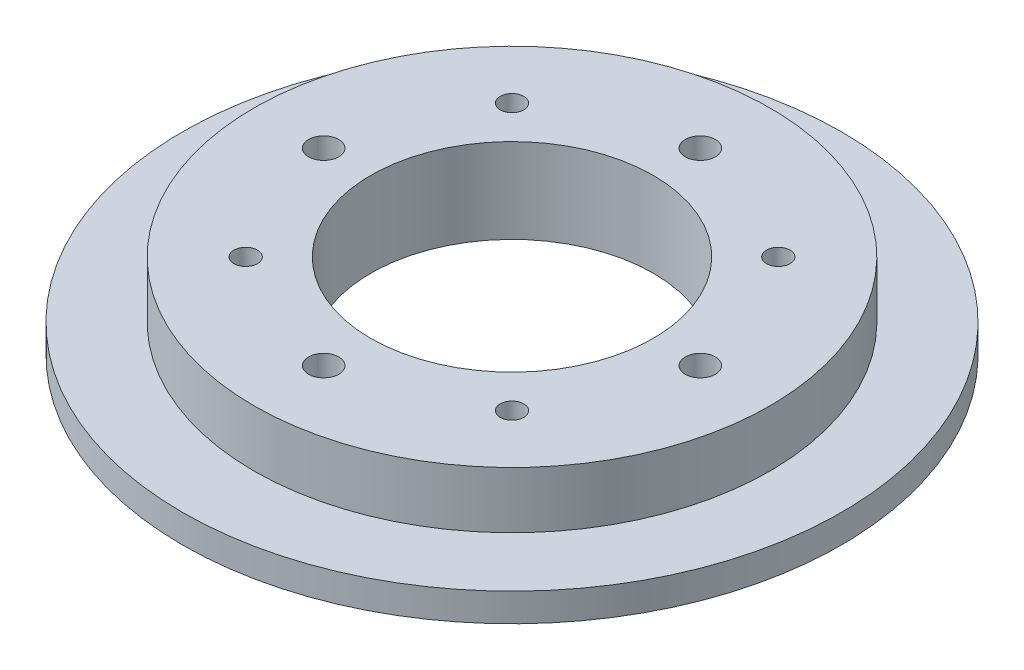
from build123d import *

# Parameters (mm, degrees)
SKETCH_1_R          = 35
EXTRUDE_1_DEPTH     = 3
SKETCH_2_R          = 27.4
EXTRUDE_2_DEPTH     = 6
SKETCH_3_R          = 1.6
CUT_EXTRUDE_1_DEPTH = 51.309044912
SKETCH_4_R          = 15
CUT_EXTRUDE_2_DEPTH = 51.309044912
SKETCH_5_R          = 1.25
CUT_EXTRUDE_3_DEPTH = 51.309044912


with BuildPart() as part:
    # ｽｹｯﾁ1 → ﾎﾞｽ - 押し出し1 (new body)
    with BuildSketch(Plane(origin=(0, 0, 0), x_dir=(1, 0, 0), z_dir=(0, 1, 0))):
        with Locations(Location((0, 0, 0), (0, 0, 270))):
            Circle(SKETCH_1_R)
    extrude(amount=EXTRUDE_1_DEPTH)

    # ｽｹｯﾁ2 → ﾎﾞｽ - 押し出し2 (add)
    with BuildSketch(Plane(origin=(0, 3, 0), x_dir=(1, 0, 0), z_dir=(0, 1, 0))):
        with Locations(Location((0, 0, 0), (0, 0, 270))):
            Circle(SKETCH_2_R)
    extrude(amount=EXTRUDE_2_DEPTH)

    # ｽｹｯﾁ3 → ｶｯﾄ - 押し出し1 (cut, through all)
    with BuildSketch(Plane(origin=(0, 9, 0), x_dir=(1, 0, 0), z_dir=(0, 1, 0))):
        with Locations(Location((0, 20, 0), (0, 0, 270))):
            Circle(SKETCH_3_R)
        with Locations(Location((20, 0, 0), (0, 0, 270))):
            Circle(SKETCH_3_R)
        with Locations(Location((0, -20, 0), (0, 0, 270))):
            Circle(SKETCH_3_R)
        with Locations(Location((-20, 0, 0), (0, 0, 270))):
            Circle(SKETCH_3_R)
    extrude(amount=-CUT_EXTRUDE_1_DEPTH, mode=Mode.SUBTRACT)

    # ｽｹｯﾁ4 → ｶｯﾄ - 押し出し2 (cut, through all)
    with BuildSketch(Plane(origin=(0, 9, 0), x_dir=(1, 0, 0), z_dir=(0, 1, 0))):
        with Locations(Location((0, 0, 0), (0, 0, 270))):
            Circle(SKETCH_4_R)
    extrude(amount=-CUT_EXTRUDE_2_DEPTH, mode=Mode.SUBTRACT)

    # ｽｹｯﾁ5 → ｶｯﾄ - 押し出し3 (cut, through all)
    with BuildSketch(Plane.XZ):
        with Locations(Location((-14.142135624, 14.142135624, 0), (0, 0, 270))):
            Circle(SKETCH_5_R)
        with Locations(Location((14.142135624, 14.142135624, 0), (0, 0, 270))):
            Circle(SKETCH_5_R)
        with Locations(Location((14.142135624, -14.142135624, 0), (0, 0, 270))):
            Circle(SKETCH_5_R)
        with Locations(Location((-14.142135624, -14.142135624, 0), (0, 0, 270))):
            Circle(SKETCH_5_R)
    extrude(amount=-CUT_EXTRUDE_3_DEPTH, mode=Mode.SUBTRACT)


solid = part.part
